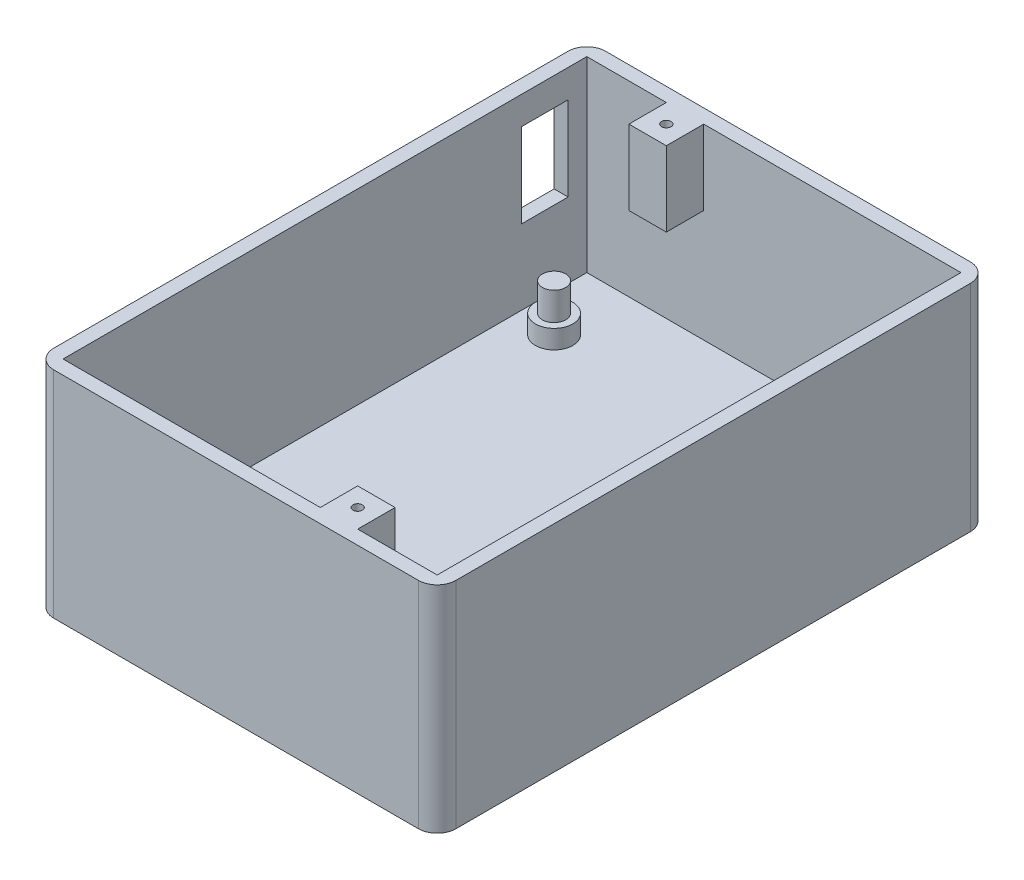
from build123d import *

# Parameters (mm, degrees)
SALIENTE_EXTRUIR1_DEPTH = 23
CROQUIS2_W              = 40
CROQUIS2_H              = 56
CORTAR_EXTRUIR1_DEPTH   = 20
CROQUIS3_R              = 2
SALIENTE_EXTRUIR2_DEPTH = 2
CROQUIS4_R              = 1.25
SALIENTE_EXTRUIR3_DEPTH = 3
CROQUIS5_W              = 4
CROQUIS5_H              = 8
SALIENTE_EXTRUIR4_DEPTH = 4
CROQUIS6_W              = 4
CROQUIS6_H              = 8
SALIENTE_EXTRUIR5_DEPTH = 4
CROQUIS7_R              = 0.5
CORTAR_EXTRUIR2_DEPTH   = 7
CORTAR_EXTRUIR3_REACH   = 58.993
CROQUIS9_W              = 5
CROQUIS9_H              = 9


with BuildPart() as part:
    # Croquis1 → Saliente-Extruir1 (new body)
    with BuildSketch(Plane(origin=(0, 0, 0), x_dir=(1, 0, 0), z_dir=(0, 1, 0))):
        with BuildLine():
            Line((-19.5, 29.5), (19.5, 29.5))
            ThreePointArc((19.5, 29.5), (20.914213562, 28.914213562), (21.5, 27.5))
            Line((21.5, 27.5), (21.5, -27.5))
            ThreePointArc((21.5, -27.5), (20.914213562, -28.914213562), (19.5, -29.5))
            Line((19.5, -29.5), (-19.5, -29.5))
            ThreePointArc((-19.5, -29.5), (-20.914213562, -28.914213562), (-21.5, -27.5))
            Line((-21.5, -27.5), (-21.5, 27.5))
            ThreePointArc((-21.5, 27.5), (-20.914213562, 28.914213562), (-19.5, 29.5))
        make_face()
    extrude(amount=SALIENTE_EXTRUIR1_DEPTH)

    # Croquis2 → Cortar-Extruir1 (cut)
    with BuildSketch(Plane(origin=(0, 23, 0), x_dir=(1, 0, 0), z_dir=(0, 1, 0))):
        Rectangle(CROQUIS2_W, CROQUIS2_H)
    extrude(amount=-CORTAR_EXTRUIR1_DEPTH, mode=Mode.SUBTRACT)

    # Croquis3 → Saliente-Extruir2 (add)
    with BuildSketch(Plane(origin=(0, 3, 0), x_dir=(1, 0, 0), z_dir=(0, 1, 0))):
        with Locations(Location((-16, 20.5, 0), (0, 0, 270))):
            Circle(CROQUIS3_R)
        with Locations(Location((2, -22.5, 0), (0, 0, 270))):
            Circle(CROQUIS3_R)
    extrude(amount=SALIENTE_EXTRUIR2_DEPTH)

    # Croquis4 → Saliente-Extruir3 (add)
    with BuildSketch(Plane(origin=(0, 5, 0), x_dir=(1, 0, 0), z_dir=(0, 1, 0))):
        with Locations(Location((-16, 20.5, 0), (0, 0, 270))):
            Circle(CROQUIS4_R)
        with Locations(Location((2, -22.5, 0), (0, 0, 270))):
            Circle(CROQUIS4_R)
    extrude(amount=SALIENTE_EXTRUIR3_DEPTH)

    # Croquis5 → Saliente-Extruir4 (add)
    with BuildSketch(Plane.XY.offset(-28)):
        with Locations((-9.5, 19)):
            Rectangle(CROQUIS5_W, CROQUIS5_H)
    extrude(amount=SALIENTE_EXTRUIR4_DEPTH)

    # Croquis6 → Saliente-Extruir5 (add)
    with BuildSketch(Plane(origin=(0, 0, 28), x_dir=(-1, 0, 0), z_dir=(0, 0, -1))):
        with Locations((-9.5, 19)):
            Rectangle(CROQUIS6_W, CROQUIS6_H)
    extrude(amount=SALIENTE_EXTRUIR5_DEPTH)

    # Croquis7 → Cortar-Extruir2 (cut)
    with BuildSketch(Plane(origin=(0, 23, 0), x_dir=(1, 0, 0), z_dir=(0, 1, 0))):
        with Locations(Location((-9.5, 26, 0), (0, 0, 270))):
            Circle(CROQUIS7_R)
        with Locations(Location((9.5, -26, 0), (0, 0, 270))):
            Circle(CROQUIS7_R)
    extrude(amount=-CORTAR_EXTRUIR2_DEPTH, mode=Mode.SUBTRACT)

    # Croquis9 → Cortar-Extruir3 (cut, up to next)
    with BuildSketch(Plane.ZY.offset(21.5), mode=Mode.PRIVATE) as cortar_extruir3_sk1:
        with Locations((-23.5, 15.5)):
            Rectangle(CROQUIS9_W, CROQUIS9_H)
    cortar_extruir3_tool1 = extrude(cortar_extruir3_sk1.sketch, amount=-CORTAR_EXTRUIR3_REACH, mode=Mode.PRIVATE) & part.part
    add(cortar_extruir3_tool1.solids().sort_by_distance((-21.5, 15.5, -23.5))[0], mode=Mode.SUBTRACT)


solid = part.part
